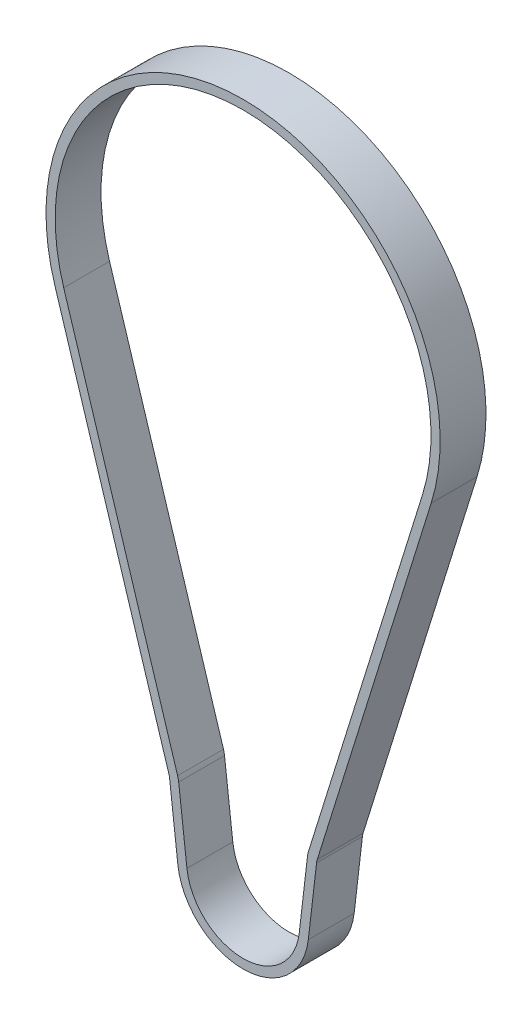
from build123d import *

# Parameters (mm, degrees)
EXTRUDE_1_DEPTH = 5


with BuildPart() as part:
    # 草图1 → 凸台-拉伸1 (new, symmetric)
    with BuildSketch(Plane.XY):
        with BuildLine():
            Line((-14.228223759, -1.662309735), (-16.027023034, 13.734170258))
            ThreePointArc((-16.027023034, 13.734170258), (-16.087215093, 14.100731168), (-16.181152473, 14.460127543))
            Line((-16.181152473, 14.460127543), (-41.023969556, 94.175054874))
            ThreePointArc((-41.023969556, 94.175054874), (0, 149.93), (41.023969556, 94.175054874))
            Line((41.023969556, 94.175054874), (16.181152473, 14.460127543))
            ThreePointArc((16.181152473, 14.460127543), (16.087215093, 14.100731168), (16.027023034, 13.734170258))
            Line((16.027023034, 13.734170258), (14.228223759, -1.662309735))
            ThreePointArc((14.228223759, -1.662309735), (0, -14.325), (-14.228223759, -1.662309735))
        make_face()
        with BuildLine():
            Line((-14.27172871, 15.055191314), (-39.114545792, 94.770118645))
            ThreePointArc((-39.114545792, 94.770118645), (0, 147.93), (39.114545792, 94.770118645))
            Line((39.114545792, 94.770118645), (14.27172871, 15.055191314))
            ThreePointArc((14.27172871, 15.055191314), (14.13082264, 14.516096752), (14.040534551, 13.966255386))
            Line((14.040534551, 13.966255386), (12.241735276, -1.430224606))
            ThreePointArc((12.241735276, -1.430224606), (0, -12.325), (-12.241735276, -1.430224606))
            Line((-12.241735276, -1.430224606), (-14.040534551, 13.966255386))
            ThreePointArc((-14.040534551, 13.966255386), (-14.13082264, 14.516096752), (-14.27172871, 15.055191314))
        make_face(mode=Mode.SUBTRACT)
    extrude(amount=EXTRUDE_1_DEPTH, both=True)


solid = part.part
